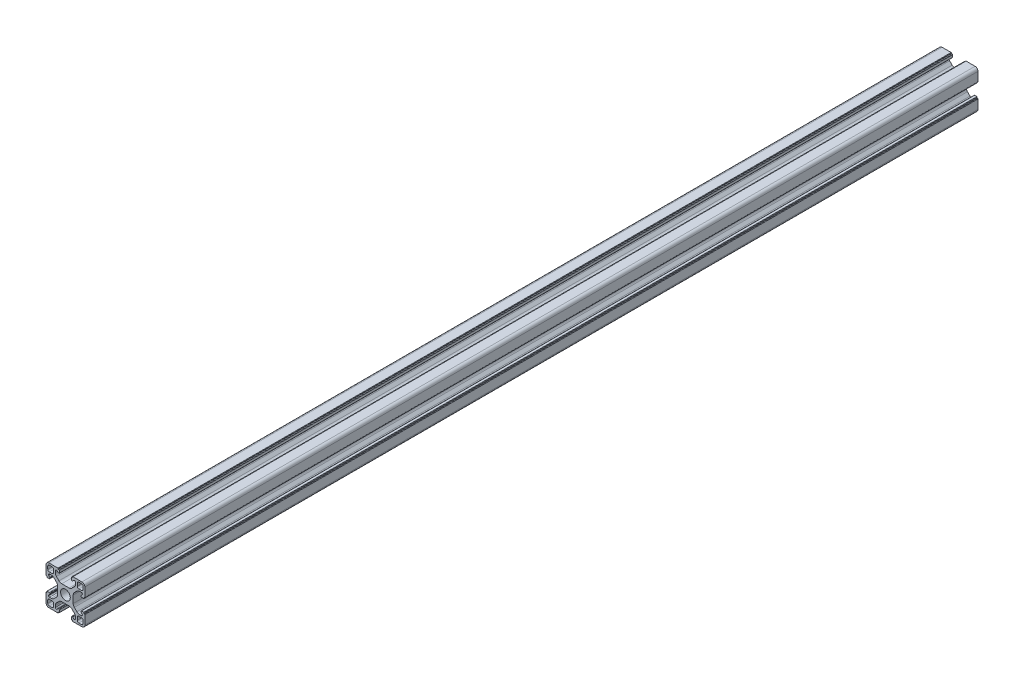
from build123d import *

# Parameters (mm, degrees)
EXTRUDE_1_DEPTH = 460


with BuildPart() as part:
    # Эскиз1 → Бобышка-Вытянуть1 (new body)
    with BuildSketch(Plane.XY):
        with BuildLine():
            Line((-31.105150957, 65.209647948), (-29.206370287, 65.209647948))
            ThreePointArc((-29.206370287, 65.209647948), (-28.441003423, 65.361888883), (-27.792156725, 65.795434385))
            Line((-27.792156725, 65.795434385), (-26.490937394, 67.096653716))
            ThreePointArc((-26.490937394, 67.096653716), (-26.057391892, 67.745500414), (-25.905150957, 68.510867279))
            Line((-25.905150957, 68.510867279), (-25.905150957, 69.409647948))
            ThreePointArc((-25.905150957, 69.409647948), (-26.051597566, 69.763201338), (-26.405150957, 69.909647948))
            Line((-26.405150957, 69.909647948), (-26.508044175, 69.909647948))
            ThreePointArc((-26.508044175, 69.909647948), (-26.699385892, 69.871587714), (-26.861597566, 69.763201338))
            Line((-26.861597566, 69.763201338), (-27.341927652, 69.282871252))
            ThreePointArc((-27.341927652, 69.282871252), (-27.423033489, 69.228678065), (-27.518704347, 69.209647948))
            Line((-27.518704347, 69.209647948), (-27.805150957, 69.209647948))
            ThreePointArc((-27.805150957, 69.209647948), (-27.981927652, 69.282871252), (-28.055150957, 69.459647948))
            Line((-28.055150957, 69.459647948), (-28.055150957, 70.608718768))
            ThreePointArc((-28.055150957, 70.608718768), (-28.011216974, 70.714784785), (-27.905150957, 70.758718768))
            Line((-27.905150957, 70.758718768), (-27.405150957, 70.758718768))
            Line((-27.405150957, 70.758718768), (-27.405150957, 71.059647948))
            ThreePointArc((-27.405150957, 71.059647948), (-27.361216974, 71.165713965), (-27.255150957, 71.209647948))
            Line((-27.255150957, 71.209647948), (-22.605150957, 71.209647948))
            ThreePointArc((-22.605150957, 71.209647948), (-21.544490785, 70.770308119), (-21.105150957, 69.709647948))
            Line((-21.105150957, 69.709647948), (-21.105150957, 65.059647948))
            ThreePointArc((-21.105150957, 65.059647948), (-21.149084939, 64.953581931), (-21.255150957, 64.909647948))
            Line((-21.255150957, 64.909647948), (-21.556080136, 64.909647948))
            Line((-21.556080136, 64.909647948), (-21.556080136, 64.409647948))
            ThreePointArc((-21.556080136, 64.409647948), (-21.600014119, 64.303581931), (-21.706080136, 64.259647948))
            Line((-21.706080136, 64.259647948), (-22.855150957, 64.259647948))
            ThreePointArc((-22.855150957, 64.259647948), (-23.031927652, 64.332871252), (-23.105150957, 64.509647948))
            Line((-23.105150957, 64.509647948), (-23.105150957, 64.796094557))
            ThreePointArc((-23.105150957, 64.796094557), (-23.08612084, 64.891765415), (-23.031927652, 64.972871252))
            Line((-23.031927652, 64.972871252), (-22.551597566, 65.453201338))
            ThreePointArc((-22.551597566, 65.453201338), (-22.44321119, 65.615413013), (-22.405150957, 65.806754729))
            Line((-22.405150957, 65.806754729), (-22.405150957, 65.909647948))
            ThreePointArc((-22.405150957, 65.909647948), (-22.551597566, 66.263201338), (-22.905150957, 66.409647948))
            Line((-22.905150957, 66.409647948), (-23.803931626, 66.409647948))
            ThreePointArc((-23.803931626, 66.409647948), (-24.56929849, 66.257407013), (-25.218145188, 65.82386151))
            Line((-25.218145188, 65.82386151), (-26.519364519, 64.522642179))
            ThreePointArc((-26.519364519, 64.522642179), (-26.952910022, 63.873795482), (-27.105150957, 63.108428617))
            Line((-27.105150957, 63.108428617), (-27.105150957, 61.209647948))
            Line((-27.105150957, 61.209647948), (-27.105150957, 59.310867279))
            ThreePointArc((-27.105150957, 59.310867279), (-26.952910022, 58.545500414), (-26.519364519, 57.896653716))
            Line((-26.519364519, 57.896653716), (-25.218145188, 56.595434385))
            ThreePointArc((-25.218145188, 56.595434385), (-24.56929849, 56.161888883), (-23.803931626, 56.009647948))
            Line((-23.803931626, 56.009647948), (-22.905150957, 56.009647948))
            ThreePointArc((-22.905150957, 56.009647948), (-22.551597566, 56.156094557), (-22.405150957, 56.509647948))
            Line((-22.405150957, 56.509647948), (-22.405150957, 56.612541166))
            ThreePointArc((-22.405150957, 56.612541166), (-22.44321119, 56.803882883), (-22.551597566, 56.966094557))
            Line((-22.551597566, 56.966094557), (-23.031927652, 57.446424643))
            ThreePointArc((-23.031927652, 57.446424643), (-23.08612084, 57.52753048), (-23.105150957, 57.623201338))
            Line((-23.105150957, 57.623201338), (-23.105150957, 57.909647948))
            ThreePointArc((-23.105150957, 57.909647948), (-23.031927652, 58.086424643), (-22.855150957, 58.159647948))
            Line((-22.855150957, 58.159647948), (-21.706080136, 58.159647948))
            ThreePointArc((-21.706080136, 58.159647948), (-21.600014119, 58.115713965), (-21.556080136, 58.009647948))
            Line((-21.556080136, 58.009647948), (-21.556080136, 57.509647948))
            Line((-21.556080136, 57.509647948), (-21.255150957, 57.509647948))
            ThreePointArc((-21.255150957, 57.509647948), (-21.149084939, 57.465713965), (-21.105150957, 57.359647948))
            Line((-21.105150957, 57.359647948), (-21.105150957, 52.709647948))
            ThreePointArc((-21.105150957, 52.709647948), (-21.544490785, 51.648987776), (-22.605150957, 51.209647948))
            Line((-22.605150957, 51.209647948), (-27.255150957, 51.209647948))
            ThreePointArc((-27.255150957, 51.209647948), (-27.361216974, 51.253581931), (-27.405150957, 51.359647948))
            Line((-27.405150957, 51.359647948), (-27.405150957, 51.660577127))
            Line((-27.405150957, 51.660577127), (-27.905150957, 51.660577127))
            ThreePointArc((-27.905150957, 51.660577127), (-28.011216974, 51.70451111), (-28.055150957, 51.810577127))
            Line((-28.055150957, 51.810577127), (-28.055150957, 52.959647948))
            ThreePointArc((-28.055150957, 52.959647948), (-27.981927652, 53.136424643), (-27.805150957, 53.209647948))
            Line((-27.805150957, 53.209647948), (-27.518704347, 53.209647948))
            ThreePointArc((-27.518704347, 53.209647948), (-27.423033489, 53.190617831), (-27.341927652, 53.136424643))
            Line((-27.341927652, 53.136424643), (-26.861597566, 52.656094557))
            ThreePointArc((-26.861597566, 52.656094557), (-26.699385892, 52.547708181), (-26.508044175, 52.509647948))
            Line((-26.508044175, 52.509647948), (-26.405150957, 52.509647948))
            ThreePointArc((-26.405150957, 52.509647948), (-26.051597566, 52.656094557), (-25.905150957, 53.009647948))
            Line((-25.905150957, 53.009647948), (-25.905150957, 53.908428617))
            ThreePointArc((-25.905150957, 53.908428617), (-26.057391892, 54.673795482), (-26.490937394, 55.322642179))
            Line((-26.490937394, 55.322642179), (-27.792156725, 56.62386151))
            ThreePointArc((-27.792156725, 56.62386151), (-28.441003423, 57.057407013), (-29.206370287, 57.209647948))
            Line((-29.206370287, 57.209647948), (-31.105150957, 57.209647948))
            Line((-31.105150957, 57.209647948), (-33.003931626, 57.209647948))
            ThreePointArc((-33.003931626, 57.209647948), (-33.76929849, 57.057407013), (-34.418145188, 56.62386151))
            Line((-34.418145188, 56.62386151), (-35.719364519, 55.322642179))
            ThreePointArc((-35.719364519, 55.322642179), (-36.152910022, 54.673795482), (-36.305150957, 53.908428617))
            Line((-36.305150957, 53.908428617), (-36.305150957, 53.009647948))
            ThreePointArc((-36.305150957, 53.009647948), (-36.158704347, 52.656094557), (-35.805150957, 52.509647948))
            Line((-35.805150957, 52.509647948), (-35.702257738, 52.509647948))
            ThreePointArc((-35.702257738, 52.509647948), (-35.510916022, 52.547708181), (-35.348704347, 52.656094557))
            Line((-35.348704347, 52.656094557), (-34.868374261, 53.136424643))
            ThreePointArc((-34.868374261, 53.136424643), (-34.787268424, 53.190617831), (-34.691597566, 53.209647948))
            Line((-34.691597566, 53.209647948), (-34.405150957, 53.209647948))
            ThreePointArc((-34.405150957, 53.209647948), (-34.228374261, 53.136424643), (-34.155150957, 52.959647948))
            Line((-34.155150957, 52.959647948), (-34.155150957, 51.810577127))
            ThreePointArc((-34.155150957, 51.810577127), (-34.199084939, 51.70451111), (-34.305150957, 51.660577127))
            Line((-34.305150957, 51.660577127), (-34.805150957, 51.660577127))
            Line((-34.805150957, 51.660577127), (-34.805150957, 51.359647948))
            ThreePointArc((-34.805150957, 51.359647948), (-34.849084939, 51.253581931), (-34.955150957, 51.209647948))
            Line((-34.955150957, 51.209647948), (-39.605150957, 51.209647948))
            ThreePointArc((-39.605150957, 51.209647948), (-40.665811128, 51.648987776), (-41.105150957, 52.709647948))
            Line((-41.105150957, 52.709647948), (-41.105150957, 57.359647948))
            ThreePointArc((-41.105150957, 57.359647948), (-41.061216974, 57.465713965), (-40.955150957, 57.509647948))
            Line((-40.955150957, 57.509647948), (-40.654221777, 57.509647948))
            Line((-40.654221777, 57.509647948), (-40.654221777, 58.009647948))
            ThreePointArc((-40.654221777, 58.009647948), (-40.610287794, 58.115713965), (-40.504221777, 58.159647948))
            Line((-40.504221777, 58.159647948), (-39.355150957, 58.159647948))
            ThreePointArc((-39.355150957, 58.159647948), (-39.178374261, 58.086424643), (-39.105150957, 57.909647948))
            Line((-39.105150957, 57.909647948), (-39.105150957, 57.623201338))
            ThreePointArc((-39.105150957, 57.623201338), (-39.124181073, 57.52753048), (-39.178374261, 57.446424643))
            Line((-39.178374261, 57.446424643), (-39.658704347, 56.966094557))
            ThreePointArc((-39.658704347, 56.966094557), (-39.767090723, 56.803882883), (-39.805150957, 56.612541166))
            Line((-39.805150957, 56.612541166), (-39.805150957, 56.509647948))
            ThreePointArc((-39.805150957, 56.509647948), (-39.658704347, 56.156094557), (-39.305150957, 56.009647948))
            Line((-39.305150957, 56.009647948), (-38.406370287, 56.009647948))
            ThreePointArc((-38.406370287, 56.009647948), (-37.641003423, 56.161888883), (-36.992156725, 56.595434385))
            Line((-36.992156725, 56.595434385), (-35.690937394, 57.896653716))
            ThreePointArc((-35.690937394, 57.896653716), (-35.257391892, 58.545500414), (-35.105150957, 59.310867279))
            Line((-35.105150957, 59.310867279), (-35.105150957, 61.209647948))
            Line((-35.105150957, 61.209647948), (-35.105150957, 63.108428617))
            ThreePointArc((-35.105150957, 63.108428617), (-35.257391892, 63.873795482), (-35.690937394, 64.522642179))
            Line((-35.690937394, 64.522642179), (-36.992156725, 65.82386151))
            ThreePointArc((-36.992156725, 65.82386151), (-37.641003423, 66.257407013), (-38.406370287, 66.409647948))
            Line((-38.406370287, 66.409647948), (-39.305150957, 66.409647948))
            ThreePointArc((-39.305150957, 66.409647948), (-39.658704347, 66.263201338), (-39.805150957, 65.909647948))
            Line((-39.805150957, 65.909647948), (-39.805150957, 65.806754729))
            ThreePointArc((-39.805150957, 65.806754729), (-39.767090723, 65.615413013), (-39.658704347, 65.453201338))
            Line((-39.658704347, 65.453201338), (-39.178374261, 64.972871252))
            ThreePointArc((-39.178374261, 64.972871252), (-39.124181073, 64.891765415), (-39.105150957, 64.796094557))
            Line((-39.105150957, 64.796094557), (-39.105150957, 64.509647948))
            ThreePointArc((-39.105150957, 64.509647948), (-39.178374261, 64.332871252), (-39.355150957, 64.259647948))
            Line((-39.355150957, 64.259647948), (-40.504221777, 64.259647948))
            ThreePointArc((-40.504221777, 64.259647948), (-40.610287794, 64.303581931), (-40.654221777, 64.409647948))
            Line((-40.654221777, 64.409647948), (-40.654221777, 64.909647948))
            Line((-40.654221777, 64.909647948), (-40.955150957, 64.909647948))
            ThreePointArc((-40.955150957, 64.909647948), (-41.061216974, 64.953581931), (-41.105150957, 65.059647948))
            Line((-41.105150957, 65.059647948), (-41.105150957, 69.709647948))
            ThreePointArc((-41.105150957, 69.709647948), (-40.665811128, 70.770308119), (-39.605150957, 71.209647948))
            Line((-39.605150957, 71.209647948), (-34.955150957, 71.209647948))
            ThreePointArc((-34.955150957, 71.209647948), (-34.849084939, 71.165713965), (-34.805150957, 71.059647948))
            Line((-34.805150957, 71.059647948), (-34.805150957, 70.758718768))
            Line((-34.805150957, 70.758718768), (-34.305150957, 70.758718768))
            ThreePointArc((-34.305150957, 70.758718768), (-34.199084939, 70.714784785), (-34.155150957, 70.608718768))
            Line((-34.155150957, 70.608718768), (-34.155150957, 69.459647948))
            ThreePointArc((-34.155150957, 69.459647948), (-34.228374261, 69.282871252), (-34.405150957, 69.209647948))
            Line((-34.405150957, 69.209647948), (-34.691597566, 69.209647948))
            ThreePointArc((-34.691597566, 69.209647948), (-34.787268424, 69.228678065), (-34.868374261, 69.282871252))
            Line((-34.868374261, 69.282871252), (-35.348704347, 69.763201338))
            ThreePointArc((-35.348704347, 69.763201338), (-35.510916022, 69.871587714), (-35.702257738, 69.909647948))
            Line((-35.702257738, 69.909647948), (-35.805150957, 69.909647948))
            ThreePointArc((-35.805150957, 69.909647948), (-36.158704347, 69.763201338), (-36.305150957, 69.409647948))
            Line((-36.305150957, 69.409647948), (-36.305150957, 68.510867279))
            ThreePointArc((-36.305150957, 68.510867279), (-36.152910022, 67.745500414), (-35.719364519, 67.096653716))
            Line((-35.719364519, 67.096653716), (-34.418145188, 65.795434385))
            ThreePointArc((-34.418145188, 65.795434385), (-33.76929849, 65.361888883), (-33.003931626, 65.209647948))
            Line((-33.003931626, 65.209647948), (-31.105150957, 65.209647948))
        make_face()
        with BuildLine():
            Line((-24.205150957, 67.309647948), (-22.805150957, 67.309647948))
            ThreePointArc((-22.805150957, 67.309647948), (-22.239465532, 67.543962523), (-22.005150957, 68.109647948))
            Line((-22.005150957, 68.109647948), (-22.005150957, 69.509647948))
            ThreePointArc((-22.005150957, 69.509647948), (-22.239465532, 70.075333373), (-22.805150957, 70.309647948))
            Line((-22.805150957, 70.309647948), (-24.205150957, 70.309647948))
            ThreePointArc((-24.205150957, 70.309647948), (-24.770836381, 70.075333373), (-25.005150957, 69.509647948))
            Line((-25.005150957, 69.509647948), (-25.005150957, 68.109647948))
            ThreePointArc((-25.005150957, 68.109647948), (-24.770836381, 67.543962523), (-24.205150957, 67.309647948))
        make_face(mode=Mode.SUBTRACT)
        with BuildLine():
            Line((-25.005150957, 54.309647948), (-25.005150957, 52.909647948))
            ThreePointArc((-25.005150957, 52.909647948), (-24.770836381, 52.343962523), (-24.205150957, 52.109647948))
            Line((-24.205150957, 52.109647948), (-22.805150957, 52.109647948))
            ThreePointArc((-22.805150957, 52.109647948), (-22.239465532, 52.343962523), (-22.005150957, 52.909647948))
            Line((-22.005150957, 52.909647948), (-22.005150957, 54.309647948))
            ThreePointArc((-22.005150957, 54.309647948), (-22.239465532, 54.875333373), (-22.805150957, 55.109647948))
            Line((-22.805150957, 55.109647948), (-24.205150957, 55.109647948))
            ThreePointArc((-24.205150957, 55.109647948), (-24.770836381, 54.875333373), (-25.005150957, 54.309647948))
        make_face(mode=Mode.SUBTRACT)
        with BuildLine():
            Line((-38.005150957, 55.109647948), (-39.405150957, 55.109647948))
            ThreePointArc((-39.405150957, 55.109647948), (-39.970836381, 54.875333373), (-40.205150957, 54.309647948))
            Line((-40.205150957, 54.309647948), (-40.205150957, 52.909647948))
            ThreePointArc((-40.205150957, 52.909647948), (-39.970836381, 52.343962523), (-39.405150957, 52.109647948))
            Line((-39.405150957, 52.109647948), (-38.005150957, 52.109647948))
            ThreePointArc((-38.005150957, 52.109647948), (-37.439465532, 52.343962523), (-37.205150957, 52.909647948))
            Line((-37.205150957, 52.909647948), (-37.205150957, 54.309647948))
            ThreePointArc((-37.205150957, 54.309647948), (-37.439465532, 54.875333373), (-38.005150957, 55.109647948))
        make_face(mode=Mode.SUBTRACT)
        with BuildLine():
            Line((-37.205150957, 68.109647948), (-37.205150957, 69.509647948))
            ThreePointArc((-37.205150957, 69.509647948), (-37.439465532, 70.075333373), (-38.005150957, 70.309647948))
            Line((-38.005150957, 70.309647948), (-39.405150957, 70.309647948))
            ThreePointArc((-39.405150957, 70.309647948), (-39.970836381, 70.075333373), (-40.205150957, 69.509647948))
            Line((-40.205150957, 69.509647948), (-40.205150957, 68.109647948))
            ThreePointArc((-40.205150957, 68.109647948), (-39.970836381, 67.543962523), (-39.405150957, 67.309647948))
            Line((-39.405150957, 67.309647948), (-38.005150957, 67.309647948))
            ThreePointArc((-38.005150957, 67.309647948), (-37.439465532, 67.543962523), (-37.205150957, 68.109647948))
        make_face(mode=Mode.SUBTRACT)
        with BuildLine():
            ThreePointArc((-28.605150957, 61.209647948), (-29.337384004, 62.977414901), (-31.105150957, 63.709647948))
            ThreePointArc((-31.105150957, 63.709647948), (-32.87291791, 62.977414901), (-33.605150957, 61.209647948))
            ThreePointArc((-33.605150957, 61.209647948), (-32.87291791, 59.441880995), (-31.105150957, 58.709647948))
            ThreePointArc((-31.105150957, 58.709647948), (-29.337384004, 59.441880995), (-28.605150957, 61.209647948))
        make_face(mode=Mode.SUBTRACT)
    extrude(amount=EXTRUDE_1_DEPTH)


solid = part.part
